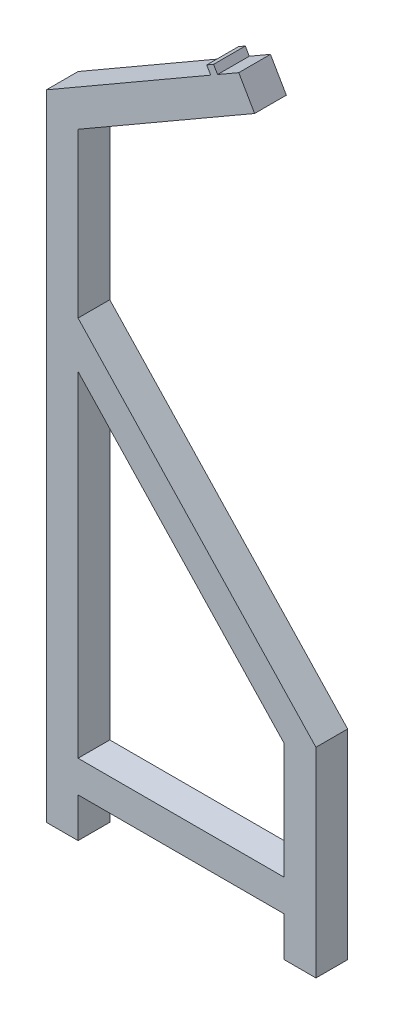
from build123d import *

# Parameters (mm, degrees)
EXTRUDE_1_DEPTH = 4


with BuildPart() as part:
    # 草图1 → 凸台-拉伸1 (new body)
    with BuildSketch(Plane.XY):
        Polygon((-163.090909091, -166.072727273), (-193.090909091, -134.197202987), (-193.090909091, -113.582128349), (-170.824877277, -100.726828888), (-172.824877277, -97.262727273), (-175.497524751, -98.805781011), (-175.997524751, -97.939755608), (-176.863550155, -98.439755608), (-176.363550155, -99.305781011), (-197.090909091, -111.272727273), (-197.090909091, -191.272727273), (-193.090909091, -191.272727273), (-193.090909091, -186.272727273), (-167.090909091, -186.272727273), (-167.090909091, -191.272727273), (-163.090909091, -191.272727273), align=None)
        Polygon((-193.090909091, -182.272727273), (-167.090909091, -182.272727273), (-167.090909091, -167.659017038), (-193.090909091, -140.033562656), align=None, mode=Mode.SUBTRACT)
    extrude(amount=EXTRUDE_1_DEPTH)


solid = part.part
